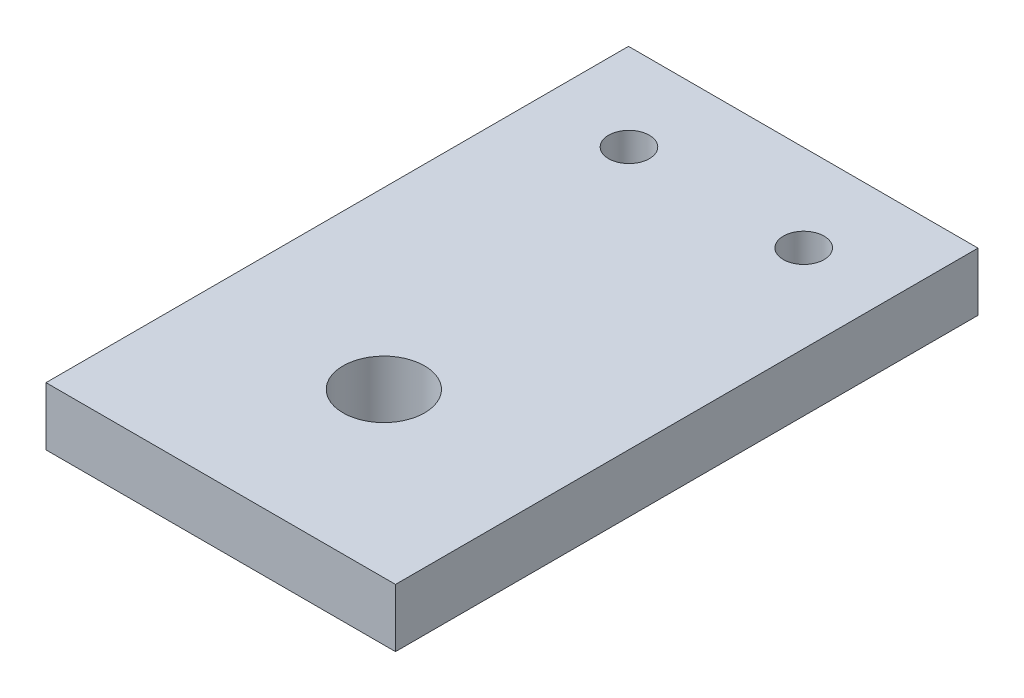
from build123d import *

# Parameters (mm, degrees)
SKETCH_2_W          = 30
SKETCH_2_H          = 50
SKETCH_2_R          = 3.5
EXTRUDE_1_DEPTH     = 5
SKETCH_4_R          = 1.75
CUT_EXTRUDE_1_DEPTH = 10


with BuildPart() as part:
    # 스케치2 → 보스-돌출1 (new body)
    with BuildSketch(Plane(origin=(0, 0, 0), x_dir=(1, 0, 0), z_dir=(0, 1, 0))):
        with Locations((0, 11)):
            Rectangle(SKETCH_2_W, SKETCH_2_H)
        with Locations(Location((0, 0, 0), (0, 0, 270))):
            Circle(SKETCH_2_R, mode=Mode.SUBTRACT)
    extrude(amount=EXTRUDE_1_DEPTH)

    # 스케치4 → 컷-돌출1 (cut)
    with BuildSketch(Plane.XZ):
        with Locations(Location((7.5, -28.539103593, 0), (0, 0, 270))):
            Circle(SKETCH_4_R)
        with Locations(Location((-7.5, -28.539103593, 0), (0, 0, 270))):
            Circle(SKETCH_4_R)
    extrude(amount=-CUT_EXTRUDE_1_DEPTH, mode=Mode.SUBTRACT)


solid = part.part
